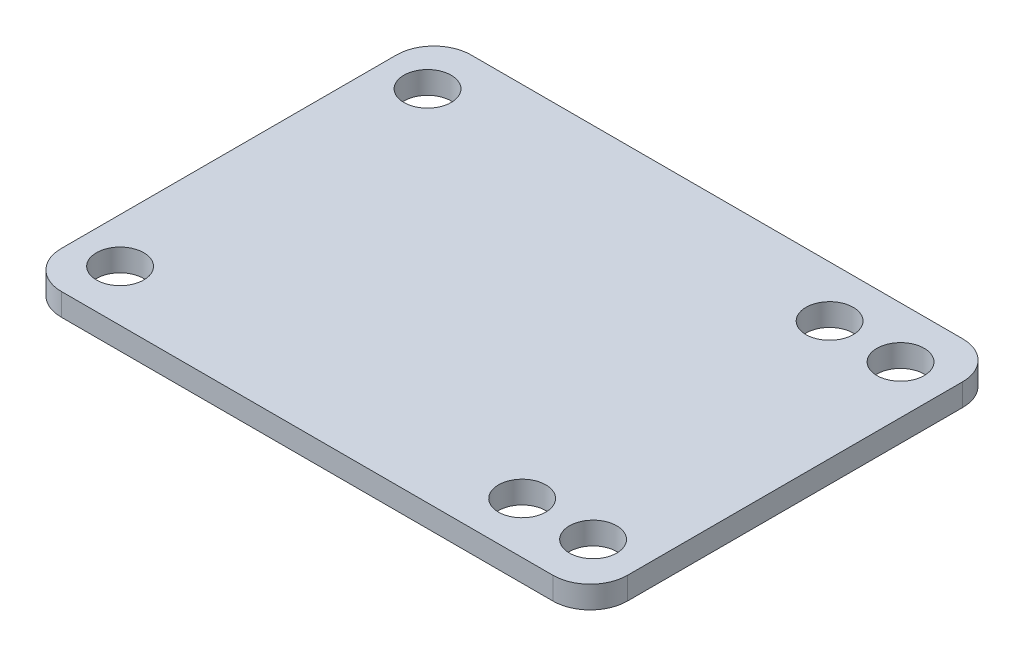
from build123d import *

# Parameters (mm, degrees)
SKETCH1_W           = 76
SKETCH1_H           = 55
BOSS_EXTRUDE1_DEPTH = 3
FILLET2_R           = 5
SKETCH2_R           = 3.175
CUT_EXTRUDE1_DEPTH  = 94.861600242


with BuildPart() as part:
    # Sketch1 → Boss-Extrude1 (new body)
    with BuildSketch(Plane(origin=(0, 0, 0), x_dir=(1, 0, 0), z_dir=(0, 1, 0))):
        with Locations((38, 27.5)):
            Rectangle(SKETCH1_W, SKETCH1_H)
    extrude(amount=BOSS_EXTRUDE1_DEPTH)

    # Fillet2
    fillet2_edges = [part.edges().sort_by_distance(p)[0] for p in [
        (0, 1.5, -55),
        (76, 1.5, -55),
        (76, 1.5, 0),
        (0, 1.5, 0),
    ]]
    fillet(fillet2_edges, radius=FILLET2_R)

    # Sketch2 → Cut-Extrude1 (cut, through all)
    with BuildSketch(Plane(origin=(0, 3, 0), x_dir=(1, 0, 0), z_dir=(0, 1, 0))):
        with Locations(Location((6.025, 48.1375, 0), (0, 0, 270))):
            Circle(SKETCH2_R)
        with Locations(Location((60, 48.1375, 0), (0, 0, 270))):
            Circle(SKETCH2_R)
        with Locations(Location((69.525, 48.1375, 0), (0, 0, 270))):
            Circle(SKETCH2_R)
        with Locations(Location((69.525, 6.8625, 0), (0, 0, 270))):
            Circle(SKETCH2_R)
        with Locations(Location((60, 6.8625, 0), (0, 0, 270))):
            Circle(SKETCH2_R)
        with Locations(Location((6.025, 6.8625, 0), (0, 0, 270))):
            Circle(SKETCH2_R)
    extrude(amount=-CUT_EXTRUDE1_DEPTH, mode=Mode.SUBTRACT)


solid = part.part
